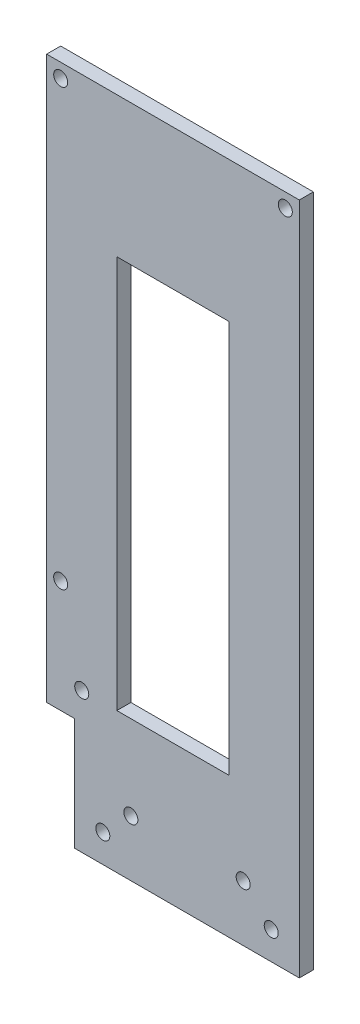
from build123d import *

# Parameters (mm, degrees)
SKETCH1_W           = 80
SKETCH1_H           = 280
BOSS_EXTRUDE1_DEPTH = 10
SKETCH6_R           = 5
CUT_EXTRUDE3_DEPTH  = 10


with BuildPart() as part:
    # Sketch1 → Boss-Extrude1 (new body)
    with BuildSketch(Plane.XY):
        Polygon((-90, -160), (-70, -160), (-70, -240), (90, -240), (90, 240), (-90, 240), align=None)
        Rectangle(SKETCH1_W, SKETCH1_H, mode=Mode.SUBTRACT)
    extrude(amount=BOSS_EXTRUDE1_DEPTH)

    # Sketch6 → Cut-Extrude3 (cut)
    with BuildSketch(Plane.XY.offset(10)):
        with Locations((-50, -220)):
            Circle(SKETCH6_R)
        with Locations((-30, -200)):
            Circle(SKETCH6_R)
        with Locations(Location((70, -220, 0), (0, 0, 180))):
            Circle(SKETCH6_R)
        with Locations(Location((50, -200, 0), (0, 0, 180))):
            Circle(SKETCH6_R)
        with Locations((-80, 230)):
            Circle(SKETCH6_R)
        with Locations((80, 230)):
            Circle(SKETCH6_R)
        with Locations((-80, -80)):
            Circle(SKETCH6_R)
        with Locations((-65, -140)):
            Circle(SKETCH6_R)
    extrude(amount=-CUT_EXTRUDE3_DEPTH, mode=Mode.SUBTRACT)


solid = part.part
